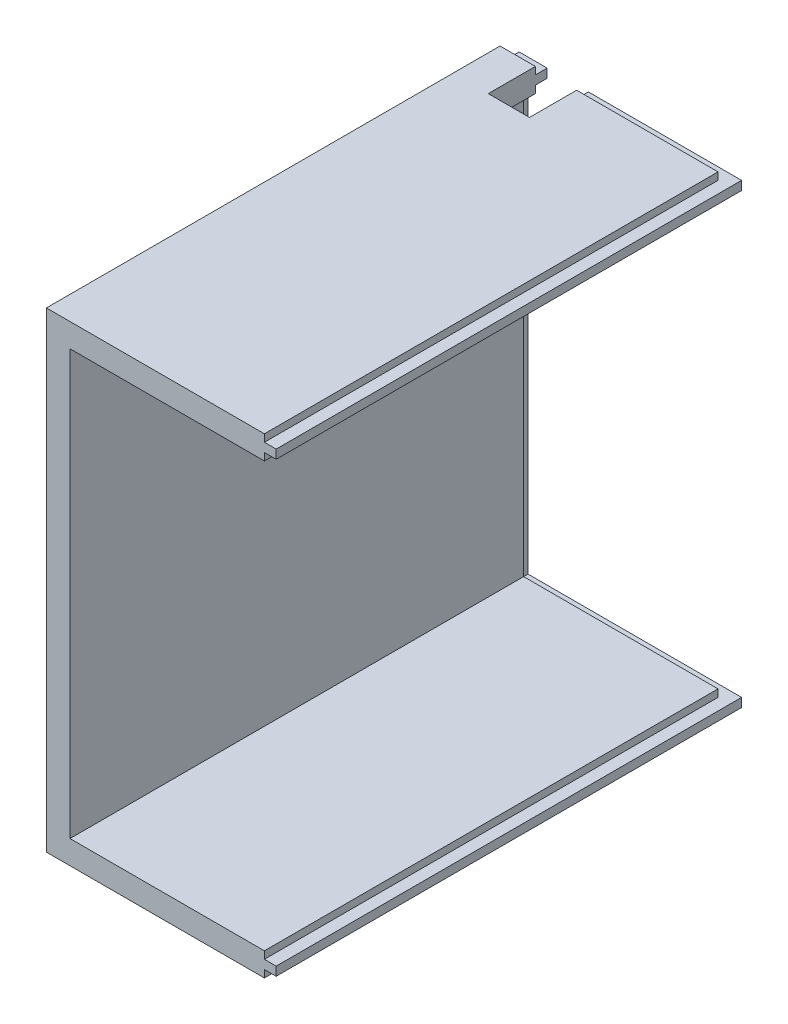
from build123d import *

# Parameters (mm, degrees)
Y_KSEKLIK_EKSTR_ZYON2_DEPTH = 77
IZIM3_W                     = 2
IZIM3_H                     = 1.25
KES_EKSTR_ZYON1_DEPTH       = 77
IZIM6_W                     = 1.5
IZIM6_H                     = 74.5
Y_KSEKLIK_EKSTR_ZYON3_DEPTH = 2
IZIM7_W                     = 7
IZIM7_H                     = 10
KES_EKSTR_ZYON2_DEPTH       = 5


with BuildPart() as part:
    # Çizim2 → Yükseklik-Ekstrüzyon2 (new body)
    with BuildSketch(Plane.XY):
        Polygon((19.5, 40), (-19.5, 40), (-19.5, -40), (19.5, -40), (19.5, -36), (-15.5, -36), (-15.5, 36), (19.5, 36), align=None)
    extrude(amount=-Y_KSEKLIK_EKSTR_ZYON2_DEPTH)

    # Çizim3 → Kes-Ekstrüzyon1 (cut)
    with BuildSketch(Plane(origin=(0, 0, -77), x_dir=(-1, 0, 0), z_dir=(0, 0, -1))):
        with Locations((-18.5, -36.625)):
            Rectangle(IZIM3_W, IZIM3_H)
        with Locations((-18.5, -39.375)):
            Rectangle(IZIM3_W, IZIM3_H)
        with Locations((-18.5, 39.375)):
            Rectangle(IZIM3_W, IZIM3_H)
        with Locations((-18.5, 36.625)):
            Rectangle(IZIM3_W, IZIM3_H)
    extrude(amount=-KES_EKSTR_ZYON1_DEPTH, mode=Mode.SUBTRACT)

    # Çizim6 → Yükseklik-Ekstrüzyon3 (add)
    with BuildSketch(Plane(origin=(0, 0, -77), x_dir=(-1, 0, 0), z_dir=(0, 0, -1))):
        Polygon((-17.5, 38.75), (-19.5, 38.75), (-19.5, 37.25), (-17.5, 37.25), (16.75, 37.25), (18.25, 37.25), (18.25, 38.75), align=None)
        with Locations((17.5, 0)):
            Rectangle(IZIM6_W, IZIM6_H)
        Polygon((18.25, -38.75), (18.25, -37.25), (16.75, -37.25), (-17.5, -37.25), (-19.5, -37.25), (-19.5, -38.75), (-17.5, -38.75), align=None)
    extrude(amount=Y_KSEKLIK_EKSTR_ZYON3_DEPTH)

    # Çizim7 → Kes-Ekstrüzyon2 (cut)
    with BuildSketch(Plane(origin=(0, 40, 0), x_dir=(1, 0, 0), z_dir=(0, 1, 0))):
        with Locations((-10, 74)):
            Rectangle(IZIM7_W, IZIM7_H)
    extrude(amount=-KES_EKSTR_ZYON2_DEPTH, mode=Mode.SUBTRACT)


solid = part.part
